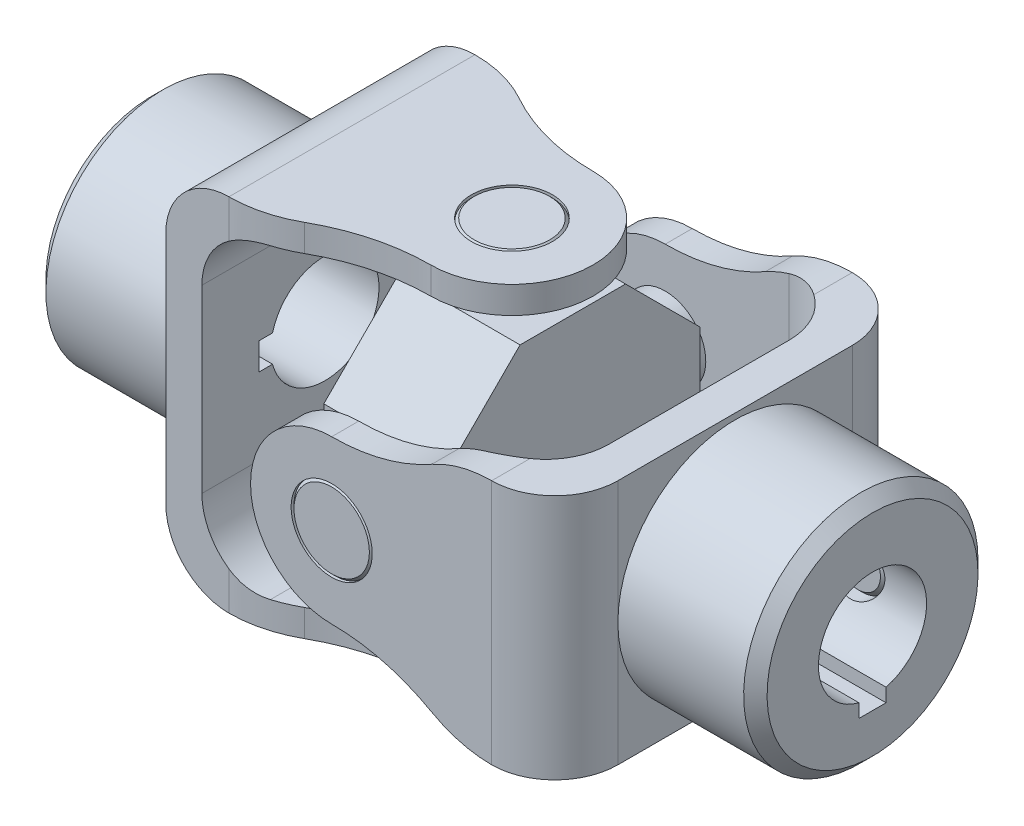
from build123d import *

# Parameters (mm, degrees)
SKETCH1_W                       = 30.559375
SKETCH1_H                       = 20.6375
BOSS_EXTRUDE6_DEPTH             = 31.75
CHAMFER1_SIZE                   = 2.06375
EXTRUDE3_DEPTH                  = 75.228527622
EXTRUDE3_DEPTH_BACK             = 75.228527622
EXTRUDE1_DEPTH                  = 75.228527622
EXTRUDE1_DEPTH_BACK             = 75.228527622
SKETCH4_R                       = 9.525
EXTRUDE4_DEPTH                  = 30.559375
EXTRUDE6_DEPTH                  = 75.228527694
EXTRUDE6_DEPTH_BACK             = 75.228527694
SKETCH6_R                       = 7.14375
SKETCH33_W                      = 2.38125
SKETCH33_H                      = 4.7625
CUT_EXTRUDE1_DEPTH              = 87.767041438
SKETCH34_R                      = 4.7625
CUT_EXTRUDE2_DEPTH              = 75.228527694
CUT_EXTRUDE3_DEPTH              = 3.302
BODY_MOVE_COPY1_ANGLE           = 90
EXTRUDE10_REACH                 = 79.771
SKETCH10_R                      = 7.14375
EXTRUDE10_DIRECTION_2_REACH     = 79.771
BOSS_EXTRUDE7_REACH             = 79.771
SKETCH31_R                      = 7.14375
BOSS_EXTRUDE7_DIRECTION_2_REACH = 79.771
BOSS_EXTRUDE8_DEPTH             = 10.715625
CHAMFER2_SIZE                   = 0.508


with BuildPart() as part:
    # Sketch1 → Revolve1 (revolve)
    with BuildSketch(Plane(origin=(0, 0, 0), x_dir=(1, 0, 0), z_dir=(0, 1, 0)), mode=Mode.PRIVATE) as revolve1_sk:
        with Locations((-48.2203125, 10.31875)):
            Rectangle(SKETCH1_W, SKETCH1_H)
    revolve(revolve1_sk.sketch.rotate(Axis((-63.5, 0, 0), (1, 0, 0)), 180), axis=Axis((-63.5, 0, 0), (1, 0, 0)))

    # Sketch30 → Boss-Extrude6 (add, symmetric)
    with BuildSketch(Plane(origin=(0, 0, 0), x_dir=(1, 0, 0), z_dir=(0, 1, 0))):
        Polygon((-39.290625, 21.669375), (-39.290625, -21.669375), (-21.828125, -21.669375), (14.2875, -21.669375), (14.2875, 21.669375), (-21.828125, 21.669375), align=None)
    extrude(amount=BOSS_EXTRUDE6_DEPTH, both=True)

    # Chamfer1
    chamfer1_edges = [part.edges().sort_by_distance(p)[0] for p in [
        (-63.5, 0, -20.6375),
    ]]
    chamfer(chamfer1_edges, length=CHAMFER1_SIZE)

    # Sketch3 → Extrude3 (cut, two sides: drawn at the far end of the back side and taken through both)
    with BuildSketch(Plane.XY.offset(-EXTRUDE3_DEPTH_BACK)):
        with BuildLine():
            Line((-21.828125, 26.9875), (32.940625, 26.9875))
            Line((32.940625, 26.9875), (32.940625, -26.9875))
            Line((32.940625, -26.9875), (-21.828125, -26.9875))
            ThreePointArc((-21.828125, -26.9875), (-29.685849106, -23.732724106), (-32.940625, -15.875))
            Line((-32.940625, -15.875), (-32.940625, 15.875))
            ThreePointArc((-32.940625, 15.875), (-29.685849106, 23.732724106), (-21.828125, 26.9875))
        make_face()
        with BuildLine():
            Line((-39.290625, 31.75), (-28.178125, 31.75))
            ThreePointArc((-28.178125, 31.75), (-36.035849106, 28.495224106), (-39.290625, 20.6375))
            Line((-39.290625, 20.6375), (-39.290625, 31.75))
        make_face()
        with BuildLine():
            Line((-39.290625, -31.75), (-39.290625, -20.6375))
            ThreePointArc((-39.290625, -20.6375), (-36.035849106, -28.495224106), (-28.178125, -31.75))
            Line((-28.178125, -31.75), (-39.290625, -31.75))
        make_face()
    extrude(amount=EXTRUDE3_DEPTH + EXTRUDE3_DEPTH_BACK, mode=Mode.SUBTRACT)

    # Sketch2 → Extrude1 (cut, two sides: drawn at the far end of the back side and taken through both)
    with BuildSketch(Plane(origin=(0, 0, 0), x_dir=(1, 0, 0), z_dir=(0, 1, 0)).offset(-EXTRUDE1_DEPTH_BACK)):
        with BuildLine():
            Line((20.6375, 31.75), (20.6375, -31.75))
            Line((20.6375, -31.75), (-21.828125, -31.75))
            Line((-21.828125, -31.75), (-28.178125, -21.669375))
            ThreePointArc((-28.178125, -21.669375), (-22.727549003, -20.967272623), (-17.632826724, -18.906803902))
            ThreePointArc((-17.632826724, -18.906803902), (-9.113925428, -15.461487614), (0, -14.2875))
            ThreePointArc((0, -14.2875), (14.2875, 0), (0, 14.2875))
            ThreePointArc((0, 14.2875), (-9.113925428, 15.461487614), (-17.632826724, 18.906803902))
            ThreePointArc((-17.632826724, 18.906803902), (-22.727549003, 20.967272623), (-28.178125, 21.669375))
            Line((-28.178125, 21.669375), (-21.828125, 31.75))
            Line((-21.828125, 31.75), (20.6375, 31.75))
        make_face()
    extrude(amount=EXTRUDE1_DEPTH + EXTRUDE1_DEPTH_BACK, mode=Mode.SUBTRACT)

    # Sketch4 → Extrude4 (cut)
    with BuildSketch(Plane.ZY.offset(63.5)):
        Circle(SKETCH4_R)
    extrude(amount=-EXTRUDE4_DEPTH, mode=Mode.SUBTRACT)

    # Sketch6 → Extrude6 (cut, two sides: drawn at the far end of the back side and taken through both)
    with BuildSketch(Plane(origin=(0, 0, 0), x_dir=(1, 0, 0), z_dir=(0, 1, 0)).offset(-EXTRUDE6_DEPTH_BACK)):
        with Locations(Location((0, 0, 0), (0, 0, 270))):
            Circle(SKETCH6_R)
    extrude(amount=EXTRUDE6_DEPTH + EXTRUDE6_DEPTH_BACK, mode=Mode.SUBTRACT)

    # Sketch33 → Cut-Extrude1 (cut, through all)
    with BuildSketch(Plane.ZY.offset(63.5)):
        with Locations((10.413166593, 0)):
            Rectangle(SKETCH33_W, SKETCH33_H)
    extrude(amount=-CUT_EXTRUDE1_DEPTH, mode=Mode.SUBTRACT)

    # Sketch34 → Cut-Extrude2 (cut, through all)
    with BuildSketch(Plane(origin=(0, 0, 0), x_dir=(1, 0, 0), z_dir=(0, 1, 0))):
        with Locations(Location((-51.3953125, 0, 0), (0, 0, 270))):
            Circle(SKETCH34_R)
    extrude(amount=-CUT_EXTRUDE2_DEPTH, mode=Mode.SUBTRACT)

    # Sketch35 → Revolve2 (revolve)
    with BuildSketch(Plane(origin=(-51.3953125, 0, 0), x_dir=(0, 0, -1), z_dir=(1, 0, 0))):
        Polygon((-3.96875, -9.525), (-4.7625, -10.31875), (-4.7625, -21.43125), (-3.96875, -22.225), (0, -22.225), (0, -9.525), align=None)
    revolve(axis=Axis((-51.3953125, -9.525, 0), (0, -1, 0)))

    # Sketch36 → Cut-Extrude3 (cut)
    with BuildSketch(Plane.XZ.offset(22.225)):
        Polygon((-51.3953125, -2.749630657), (-49.0140625, -1.374815329), (-49.0140625, 1.374815329), (-51.3953125, 2.749630657), (-53.7765625, 1.374815329), (-53.7765625, -1.374815329), align=None)
    extrude(amount=-CUT_EXTRUDE3_DEPTH, mode=Mode.SUBTRACT)

    # Cut-Extrude4 cone 1 section (through the dimple's axis) → Cut-Extrude4 (revolve, cut)
    with BuildSketch(Plane(origin=(-51.3953125, -22.225, 0), x_dir=(0, 0, -1), z_dir=(1, 0, 0))):
        Polygon((0, 0), (2.749630657, 0), (0, 2.749630657), align=None)
    revolve(axis=Axis((-51.3953125, -22.225, 0), (0, 1, 0)), mode=Mode.SUBTRACT)


with BuildPart() as body_2:
    # Mirror1: mirrored copy
    add(part.part.mirror(Plane(origin=(0, 0, 0), x_dir=(0, 0, 1), z_dir=(1, 0, 0))))


with BuildPart() as body_2_1:
    # Body-Move/Copy1: moved
    add(body_2.part.rotate(Axis((0, 0, 0), (1, 0, 0)), BODY_MOVE_COPY1_ANGLE))


with BuildPart() as body_3:

    # Extrude10: up to this face of the body (flat: up to its plane)
    extrude10_end = Plane(body_2_1.part.faces().sort_by_distance((11.501264711, 0, 31.75))[0])
    # Sketch10 → Extrude10 (new, up to the picked face)
    with BuildSketch(Plane.XY, mode=Mode.PRIVATE) as extrude10_sk1:
        with Locations(Location((0, 0, 0), (0, 0, 90))):
            Circle(SKETCH10_R)
    extrude10_tool1 = split(extrude(extrude10_sk1.sketch, amount=EXTRUDE10_REACH, mode=Mode.PRIVATE), bisect_by=extrude10_end, keep=Keep.BOTH, mode=Mode.PRIVATE)
    add(extrude10_tool1.solids().sort_by(Axis((0, 0, 0), (0, 0, 1)))[0])


    # Extrude10 direction 2: up to this face of the body (flat: up to its plane)
    extrude10_direction_2_end = Plane(body_2_1.part.faces().sort_by_distance((11.501264711, 0, -31.75))[0])
    # Sketch10 → Extrude10 direction 2 (add, up to the picked face)
    with BuildSketch(Plane.XY, mode=Mode.PRIVATE) as extrude10_direction_2_sk1:
        with Locations(Location((0, 0, 0), (0, 0, 90))):
            Circle(SKETCH10_R)
    extrude10_direction_2_tool1 = split(extrude(extrude10_direction_2_sk1.sketch, amount=-EXTRUDE10_DIRECTION_2_REACH, mode=Mode.PRIVATE), bisect_by=extrude10_direction_2_end, keep=Keep.BOTH, mode=Mode.PRIVATE)
    add(extrude10_direction_2_tool1.solids().sort_by(Axis((0, 0, 0), (0, 0, -1)))[0])



with BuildPart() as body_4:

    # Boss-Extrude7: up to this face of the body (flat: up to its plane)
    boss_extrude7_end = Plane(part.part.faces().sort_by_distance((-11.501264711, -31.75, 0))[0])
    # Sketch31 → Boss-Extrude7 (new, up to the picked face)
    with BuildSketch(Plane(origin=(0, 0, 0), x_dir=(1, 0, 0), z_dir=(0, 1, 0)), mode=Mode.PRIVATE) as boss_extrude7_sk1:
        with Locations(Location((0, 0, 0), (0, 0, 270))):
            Circle(SKETCH31_R)
    boss_extrude7_tool1 = split(extrude(boss_extrude7_sk1.sketch, amount=-BOSS_EXTRUDE7_REACH, mode=Mode.PRIVATE), bisect_by=boss_extrude7_end, keep=Keep.BOTH, mode=Mode.PRIVATE)
    add(boss_extrude7_tool1.solids().sort_by(Axis((0, 0, 0), (0, -1, 0)))[0])


    # Boss-Extrude7 direction 2: up to this face of the body (flat: up to its plane)
    boss_extrude7_direction_2_end = Plane(part.part.faces().sort_by_distance((-11.501264711, 31.75, 0))[0])
    # Sketch31 → Boss-Extrude7 direction 2 (add, up to the picked face)
    with BuildSketch(Plane(origin=(0, 0, 0), x_dir=(1, 0, 0), z_dir=(0, 1, 0)), mode=Mode.PRIVATE) as boss_extrude7_direction_2_sk1:
        with Locations(Location((0, 0, 0), (0, 0, 270))):
            Circle(SKETCH31_R)
    boss_extrude7_direction_2_tool1 = split(extrude(boss_extrude7_direction_2_sk1.sketch, amount=BOSS_EXTRUDE7_DIRECTION_2_REACH, mode=Mode.PRIVATE), bisect_by=boss_extrude7_direction_2_end, keep=Keep.BOTH, mode=Mode.PRIVATE)
    add(boss_extrude7_direction_2_tool1.solids().sort_by(Axis((0, 0, 0), (0, 1, 0)))[0])


with BuildPart() as body_3_1:
    add(body_3.part)

    add(body_4.part)  # Boss-Extrude8 merges body 4
    # Sketch32 → Boss-Extrude8 (add, symmetric)
    with BuildSketch(Plane(origin=(0, 0, 0), x_dir=(0, 0, -1), z_dir=(1, 0, 0))):
        Polygon((9.286875, -22.420499577), (22.420499577, -9.286875), (22.420499577, 9.286875), (9.286875, 22.420499577), (-9.286875, 22.420499577), (-22.420499577, 9.286875), (-22.420499577, -9.286875), (-9.286875, -22.420499577), align=None)
    extrude(amount=BOSS_EXTRUDE8_DEPTH, both=True)

    # Chamfer2
    chamfer2_edges = [body_3_1.edges().sort_by_distance(p)[0] for p in [
        (0, -31.75, -7.14375),
        (0, 31.75, -7.14375),
        (0, -7.14375, 31.75),
        (0, -7.14375, -31.75),
    ]]
    chamfer(chamfer2_edges, length=CHAMFER2_SIZE)


solid = Compound([part.part, body_2_1.part, body_3_1.part])
